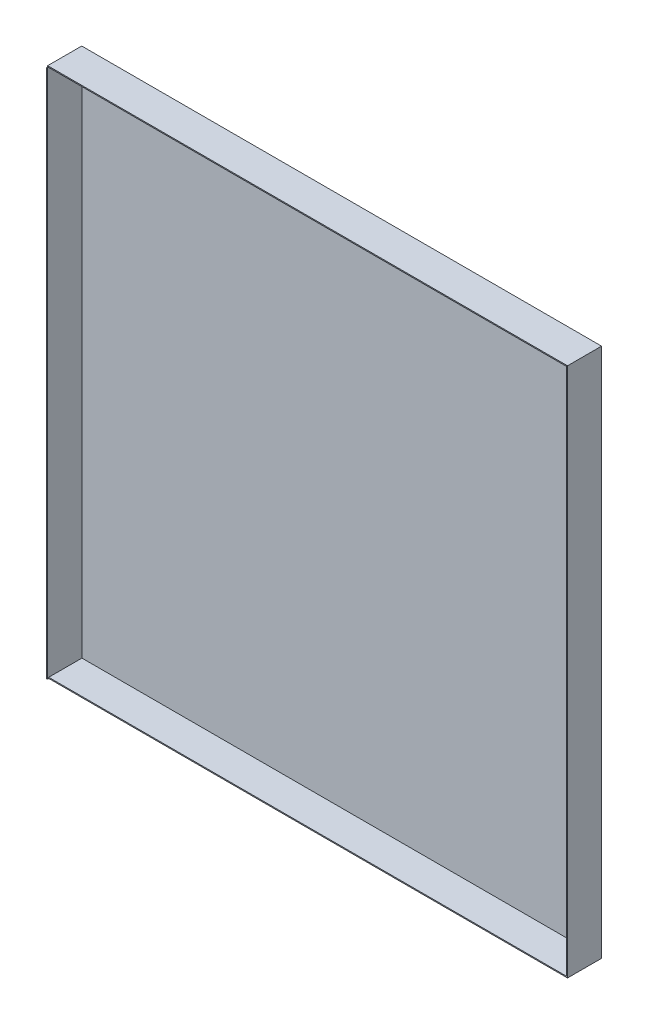
from build123d import *

# Parameters (mm, degrees)
SKETCH1_W           = 501
SKETCH1_H           = 511
BOSS_EXTRUDE1_DEPTH = 0.8
SKETCH2_W           = 501
SKETCH2_H           = 1.003667413
BOSS_EXTRUDE2_DEPTH = 32
SKETCH3_W           = 1
SKETCH3_H           = 509.996332587
BOSS_EXTRUDE3_DEPTH = 32
SKETCH7_W           = 1
SKETCH7_H           = 509.996332587
BOSS_EXTRUDE4_DEPTH = 34
SKETCH8_W           = 499
SKETCH8_H           = 1
BOSS_EXTRUDE5_DEPTH = 32


with BuildPart() as part:
    # Sketch1 → Boss-Extrude1 (new body)
    with BuildSketch(Plane.XY):
        with Locations((250.5, 255.5)):
            Rectangle(SKETCH1_W, SKETCH1_H)
    extrude(amount=BOSS_EXTRUDE1_DEPTH)

    # Sketch2 → Boss-Extrude2 (add)
    with BuildSketch(Plane.XY.offset(0.8)):
        with Locations((250.5, 510.498166294)):
            Rectangle(SKETCH2_W, SKETCH2_H)
    extrude(amount=BOSS_EXTRUDE2_DEPTH)

    # Sketch3 → Boss-Extrude3 (add)
    with BuildSketch(Plane.XY.offset(0.8)):
        with Locations((500.5, 254.998166294)):
            Rectangle(SKETCH3_W, SKETCH3_H)
    extrude(amount=BOSS_EXTRUDE3_DEPTH)

    # Sketch7 → Boss-Extrude4 (add)
    with BuildSketch(Plane(origin=(0, 0, 0), x_dir=(-1, 0, 0), z_dir=(0, 0, -1))):
        with Locations((-0.5, 254.998166294)):
            Rectangle(SKETCH7_W, SKETCH7_H)
    extrude(amount=-BOSS_EXTRUDE4_DEPTH)

    # Sketch8 → Boss-Extrude5 (add)
    with BuildSketch(Plane.XY.offset(0.8)):
        with Locations((250.5, 0.5)):
            Rectangle(SKETCH8_W, SKETCH8_H)
    extrude(amount=BOSS_EXTRUDE5_DEPTH)


solid = part.part
